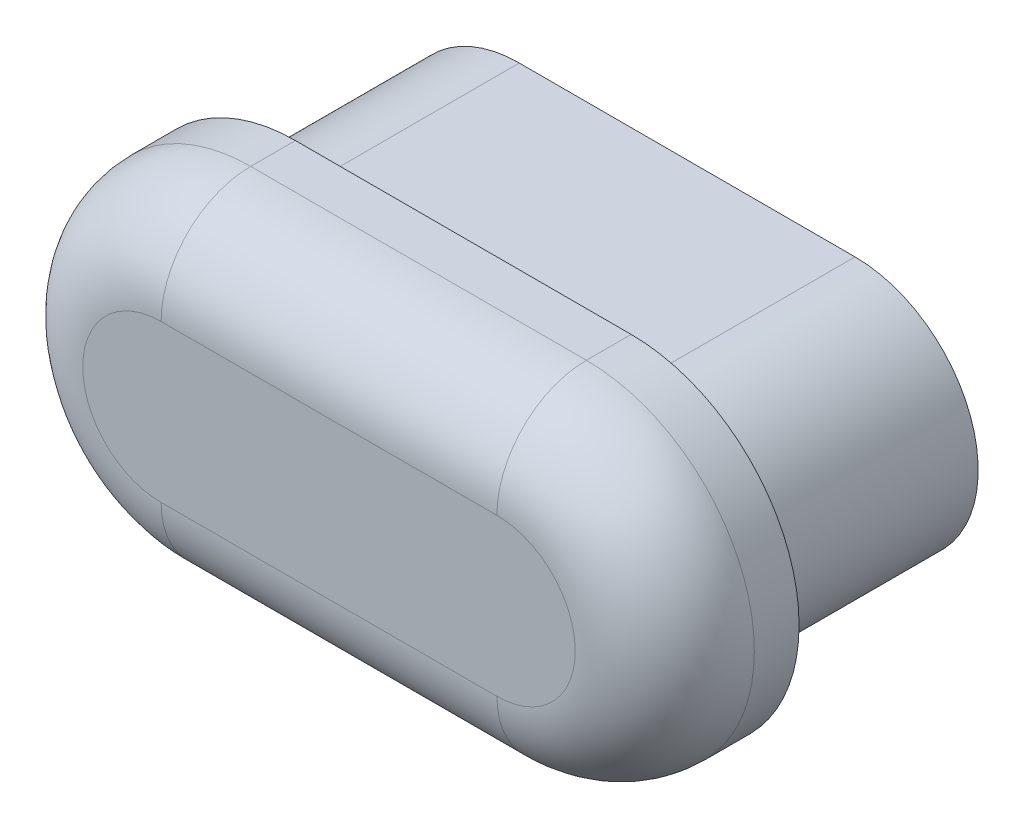
from build123d import *

# Parameters (mm, degrees)
EXTRUDE_1_DEPTH = 6
EXTRUDE_2_DEPTH = 10
FILLET_1_R      = 4


with BuildPart() as part:
    # Эскиз1 → Бобышка-Вытянуть1 (new body)
    with BuildSketch(Plane.XY):
        with BuildLine():
            Line((-7.5, 7.5), (7.5, 7.5))
            ThreePointArc((7.5, 7.5), (15, 0), (7.5, -7.5))
            Line((7.5, -7.5), (-7.5, -7.5))
            ThreePointArc((-7.5, -7.5), (-15, 0), (-7.5, 7.5))
        make_face()
    extrude(amount=EXTRUDE_1_DEPTH)

    # Эскиз2 → Бобышка-Вытянуть2 (add)
    with BuildSketch(Plane(origin=(0, 0, 0), x_dir=(-1, 0, 0), z_dir=(0, 0, -1))):
        with BuildLine():
            Line((7.5, 5.5), (-7.5, 5.5))
            ThreePointArc((-7.5, 5.5), (-13, 0), (-7.5, -5.5))
            Line((-7.5, -5.5), (7.5, -5.5))
            ThreePointArc((7.5, -5.5), (13, 0), (7.5, 5.5))
        make_face()
    extrude(amount=EXTRUDE_2_DEPTH)

    # Скругление1
    fillet_1_edges = [part.edges().sort_by_distance(p)[0] for p in [
        (15, 0, 6),
        (0, 7.5, 6),
        (-15, 0, 6),
        (0, -7.5, 6),
    ]]
    fillet(fillet_1_edges, radius=FILLET_1_R)


solid = part.part
